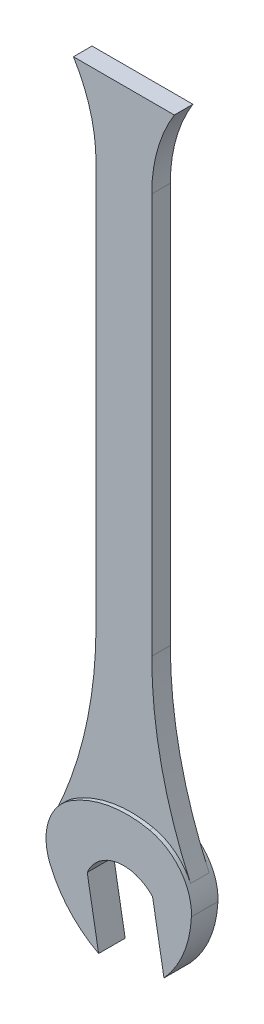
from build123d import *

# Parameters (mm, degrees)
HEAD_EXTRUDE_DEPTH        = 3.175
HEAD_EXTRUDE_DEPTH_BACK   = 3.175
HANDLE_EXTRUDE_DEPTH      = 2.2225
HANDLE_EXTRUDE_DEPTH_BACK = 2.2225


with BuildPart() as part:
    # head + handle sketch → head extrude (new, two sides: drawn at the far end of the back side and taken through both)
    with BuildSketch(Plane(origin=(0, 0, 0), x_dir=(0, 1, 0), z_dir=(0, 0, 1)).offset(-HEAD_EXTRUDE_DEPTH_BACK)):
        with BuildLine():
            Line((-16.837056671, 5.091121365), (-1.37833241, 7.81691154))
            ThreePointArc((-1.37833241, 7.81691154), (4.236175861, 0.746952099), (1.37833241, -7.81691154))
            Line((1.37833241, -7.81691154), (-14.08039185, -10.542701714))
            ThreePointArc((-14.08039185, -10.542701714), (-6.685826637, -15.212601851), (1.854333587, -17.097601941))
            ThreePointArc((1.854333587, -17.097601941), (4.855139843, -16.873528347), (7.718992867, -15.94973561))
            ThreePointArc((7.718992867, -15.94973561), (12.331168475, -12.345606251), (14.837059135, -7.055764638))
            ThreePointArc((14.837059135, -7.055764638), (15.008470156, 2.646398228), (11.52906135, 11.704823057))
            ThreePointArc((11.52906135, 11.704823057), (9.203666438, 14.458341062), (6.198407098, 16.44774781))
            ThreePointArc((6.198407098, 16.44774781), (1.073408159, 17.666453114), (-4.105220678, 16.700709816))
            ThreePointArc((-4.105220678, 16.700709816), (-11.48563822, 12.008482318), (-16.837056671, 5.091121365))
        make_face()
    extrude(amount=HEAD_EXTRUDE_DEPTH + HEAD_EXTRUDE_DEPTH_BACK)

    # Sketch2<3> → handle extrude (add, two sides: drawn at the far end of the back side and taken through both)
    with BuildSketch(Plane(origin=(0, 0, 0), x_dir=(0, 1, 0), z_dir=(0, 0, 1)).offset(-HANDLE_EXTRUDE_DEPTH_BACK)):
        with BuildLine():
            ThreePointArc((49.692005566, 6.6675), (27.402174057, 9.142712932), (6.198407098, 16.44774781))
            ThreePointArc((6.198407098, 16.44774781), (9.203666438, 14.458341062), (11.52906135, 11.704823057))
            ThreePointArc((11.52906135, 11.704823057), (15.008470156, 2.646398228), (14.837059135, -7.055764638))
            ThreePointArc((14.837059135, -7.055764638), (12.331168475, -12.345606251), (7.718992867, -15.94973561))
            ThreePointArc((7.718992867, -15.94973561), (28.430370524, -9.015182994), (50.145286343, -6.6675))
            Line((50.145286343, -6.6675), (145.898407098, -6.6675))
            ThreePointArc((145.898407098, -6.6675), (155.798350359, -8.042920845), (164.948407098, -12.065))
            Line((164.948407098, -12.065), (164.948407098, 12.065))
            ThreePointArc((164.948407098, 12.065), (155.798350359, 8.042920845), (145.898407098, 6.6675))
            Line((145.898407098, 6.6675), (49.692005566, 6.6675))
        make_face()
    extrude(amount=HANDLE_EXTRUDE_DEPTH + HANDLE_EXTRUDE_DEPTH_BACK)


solid = part.part
